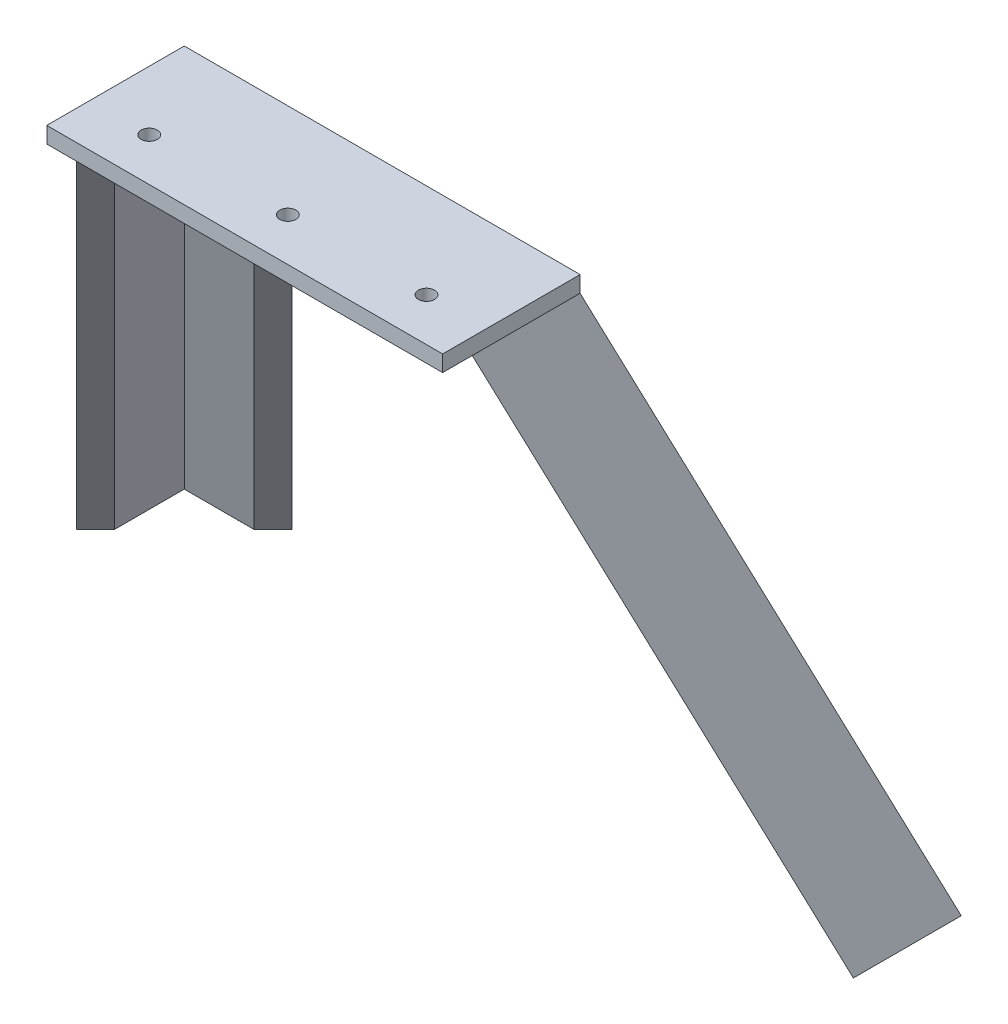
from build123d import *

# Parameters (mm, degrees)
SKETCH_8_W          = 73.42135624
SKETCH_8_H          = 25.5
EXTRUDE_3_DEPTH     = 3
SKETCH_9_R          = 1.5
CUT_EXTRUDE_2_DEPTH = 3


with BuildPart() as part:
    # 草图8 → 凸台-拉伸3 (new body)
    with BuildSketch(Plane(origin=(0, 100, 0), x_dir=(1, 0, 0), z_dir=(0, 1, 0))):
        with Locations((-11.084772404, 22.970398927)):
            Rectangle(SKETCH_8_W, SKETCH_8_H)
    extrude(amount=EXTRUDE_3_DEPTH)

    # 草图9 → 切除-拉伸2 (cut)
    with BuildSketch(Plane(origin=(0, 103, 0), x_dir=(1, 0, 0), z_dir=(0, 1, 0))):
        with Locations(Location((-36.795450524, 18.220398927, 0), (0, 0, 270))):
            Circle(SKETCH_9_R)
        with Locations(Location((14.625905716, 18.220398927, 0), (0, 0, 270))):
            Circle(SKETCH_9_R)
        with Locations(Location((-11.084772404, 18.220398927, 0), (0, 0, 270))):
            Circle(SKETCH_9_R)
    extrude(amount=-CUT_EXTRUDE_2_DEPTH, mode=Mode.SUBTRACT)

    # 草图10 → 放样2 section 0
    with BuildSketch(Plane(origin=(0, 100, 0), x_dir=(1, 0, 0), z_dir=(0, 1, 0))):
        with BuildLine():
            Line((-47.795450524, 35.720398927), (-27.795450524, 35.720398927))
            Line((-27.795450524, 35.720398927), (-47.795450524, 15.720398927))
            Line((-47.795450524, 15.720398927), (-47.795450524, 35.720398927))
        make_face()
    # 草图11 → 放样2 section 1
    with BuildSketch(Plane(origin=(0, 0, 0), x_dir=(1, 0, 0), z_dir=(0, 1, 0))):
        with BuildLine():
            Line((-83.150789583, 71.075737986), (-63.150789583, 71.075737986))
            Line((-63.150789583, 71.075737986), (-83.150789583, 51.075737986))
            Line((-83.150789583, 51.075737986), (-83.150789583, 71.075737986))
        make_face()
    loft_2 = loft()

    # 草图12 → 切除-放样1 section 0
    with BuildSketch(Plane(origin=(0, 100, 0), x_dir=(1, 0, 0), z_dir=(0, 1, 0))):
        with BuildLine():
            Line((-31.33098443, 32.184865021), (-44.259916618, 19.255932833))
            Line((-44.259916618, 19.255932833), (-44.259916618, 32.184865021))
            Line((-44.259916618, 32.184865021), (-31.33098443, 32.184865021))
        make_face()
    # 草图13 → 切除-放样1 section 1
    with BuildSketch(Plane(origin=(0, 0, 0), x_dir=(1, 0, 0), z_dir=(0, 1, 0))):
        with BuildLine():
            Line((-66.686323489, 67.54020408), (-79.615255677, 54.611271892))
            Line((-79.615255677, 54.611271892), (-79.615255677, 67.54020408))
            Line((-79.615255677, 67.54020408), (-66.686323489, 67.54020408))
        make_face()
    loft_1 = loft(mode=Mode.SUBTRACT)

    # 镜向3: 放样2 across plane
    add(loft_2.mirror(Plane(origin=(-11.1, 0, 0), x_dir=(0, 0, 1), z_dir=(1, 0, 0))))

    # 镜向4: 切除-放样1 across plane
    add(loft_1.mirror(Plane(origin=(-11.1, 0, 0), x_dir=(0, 0, 1), z_dir=(1, 0, 0))), mode=Mode.SUBTRACT)


solid = part.part
